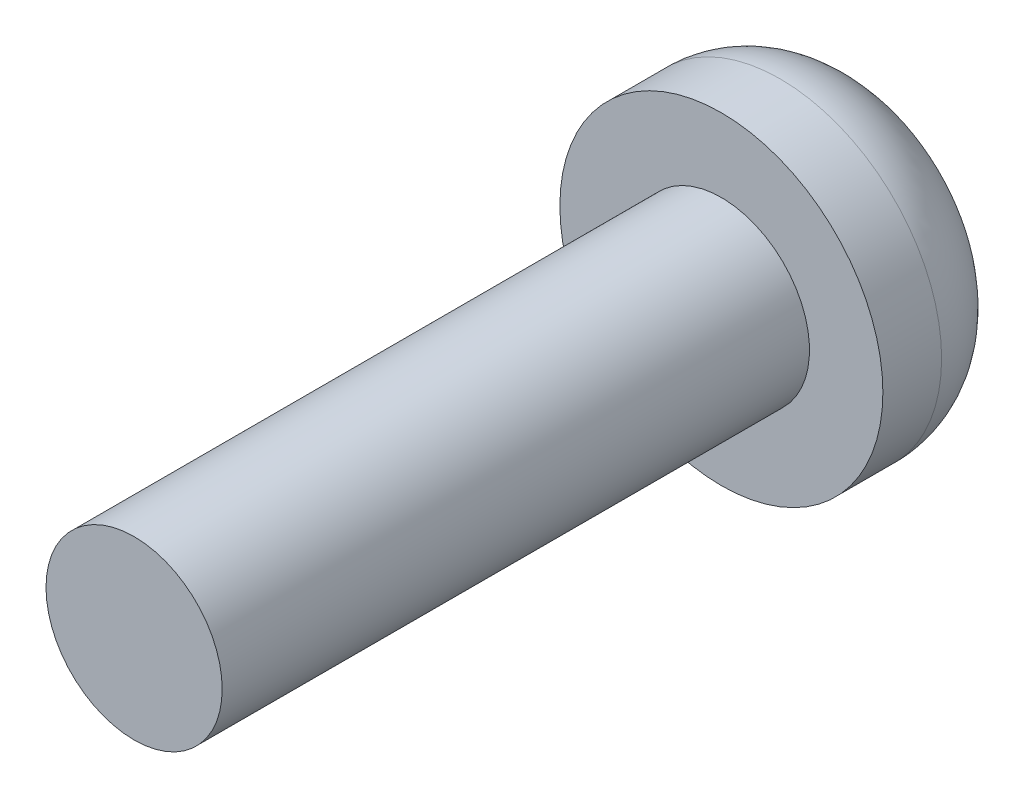
from build123d import *

# Parameters (mm, degrees)
SKETCH1_R           = 1.5
BOSS_EXTRUDE1_DEPTH = 10
SKETCH2_R           = 2.75
BOSS_EXTRUDE2_DEPTH = 2.5
FILLET1_R           = 1.5


with BuildPart() as part:
    # Sketch1 → Boss-Extrude1 (new body)
    with BuildSketch(Plane.XY):
        Circle(SKETCH1_R)
    extrude(amount=BOSS_EXTRUDE1_DEPTH)

    # Sketch2 → Boss-Extrude2 (add)
    with BuildSketch(Plane(origin=(0, 0, 0), x_dir=(-1, 0, 0), z_dir=(0, 0, -1))):
        Circle(SKETCH2_R)
    extrude(amount=BOSS_EXTRUDE2_DEPTH)

    # Fillet1
    fillet1_edges = [part.edges().sort_by_distance(p)[0] for p in [
        (2.75, 0, -2.5),
    ]]
    fillet(fillet1_edges, radius=FILLET1_R)


solid = part.part
